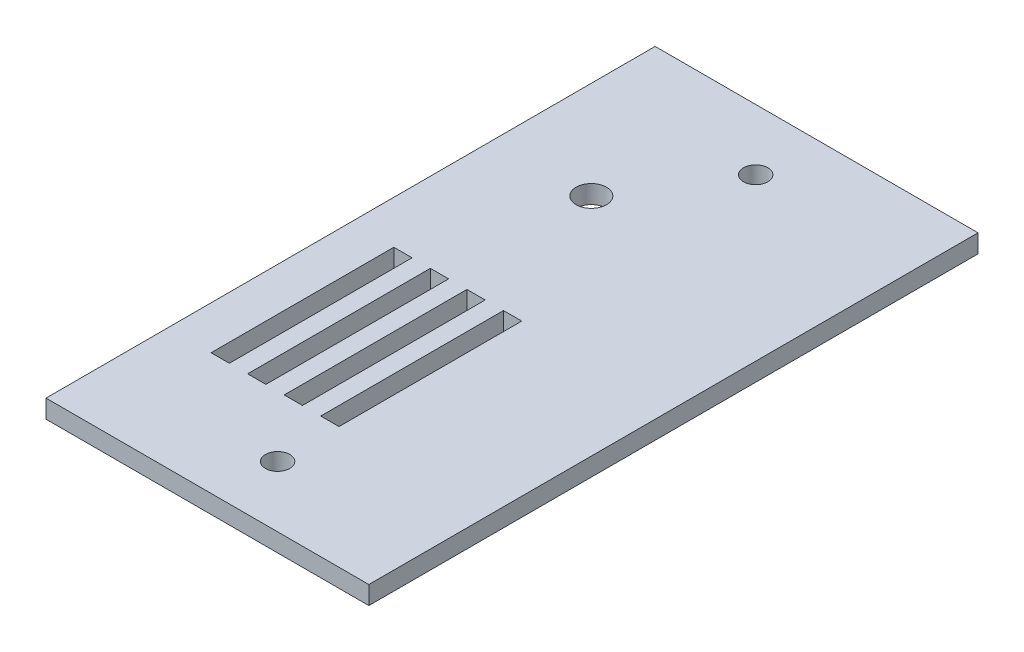
from build123d import *

# Parameters (mm, degrees)
ESBO_O2_W                = 53
ESBO_O2_H                = 100
RESSALTO_EXTRUS_O1_DEPTH = 3
ESBO_O3_R                = 2
CORTE_EXTRUS_O1_DEPTH    = 10
ESBO_O4_R                = 2.5
CORTE_EXTRUS_O3_DEPTH    = 10
ESBO_O5_R                = 2
CORTE_EXTRUS_O4_DEPTH    = 10
ESBO_O6_W                = 3
ESBO_O6_H                = 30
CORTE_EXTRUS_O8_DEPTH    = 10


with BuildPart() as part:
    # Esboço2 → Ressalto-extrusão1 (new body)
    with BuildSketch(Plane(origin=(0, 0, 0), x_dir=(1, 0, 0), z_dir=(0, 1, 0))):
        with Locations((-26.520406012, 50)):
            Rectangle(ESBO_O2_W, ESBO_O2_H)
    extrude(amount=RESSALTO_EXTRUS_O1_DEPTH)

    # Esboço3 → Corte-extrusão1 (cut)
    with BuildSketch(Plane(origin=(0, 3, 0), x_dir=(1, 0, 0), z_dir=(0, 1, 0))):
        with Locations(Location((-25, 10, 0), (0, 0, 270))):
            Circle(ESBO_O3_R)
    extrude(amount=-CORTE_EXTRUS_O1_DEPTH, mode=Mode.SUBTRACT)

    # Esboço4 → Corte-extrusão3 (cut)
    with BuildSketch(Plane(origin=(0, 3, 0), x_dir=(1, 0, 0), z_dir=(0, 1, 0))):
        with Locations(Location((-37, 73.5, 0), (0, 0, 270))):
            Circle(ESBO_O4_R)
    extrude(amount=-CORTE_EXTRUS_O3_DEPTH, mode=Mode.SUBTRACT)

    # Esboço5 → Corte-extrusão4 (cut)
    with BuildSketch(Plane(origin=(0, 3, 0), x_dir=(1, 0, 0), z_dir=(0, 1, 0))):
        with Locations(Location((-26.520406012, 90, 0), (0, 0, 270))):
            Circle(ESBO_O5_R)
    extrude(amount=-CORTE_EXTRUS_O4_DEPTH, mode=Mode.SUBTRACT)

    # Esboço6 → Corte-extrusão8 (cut)
    with BuildSketch(Plane(origin=(0, 3, 0), x_dir=(1, 0, 0), z_dir=(0, 1, 0))):
        with Locations((-44.419461936, 35)):
            Rectangle(ESBO_O6_W, ESBO_O6_H)
        with Locations((-38.419461936, 35)):
            Rectangle(ESBO_O6_W, ESBO_O6_H)
        with Locations((-32.419461936, 35)):
            Rectangle(ESBO_O6_W, ESBO_O6_H)
        with Locations((-26.419461936, 35)):
            Rectangle(ESBO_O6_W, ESBO_O6_H)
    extrude(amount=-CORTE_EXTRUS_O8_DEPTH, mode=Mode.SUBTRACT)


solid = part.part
